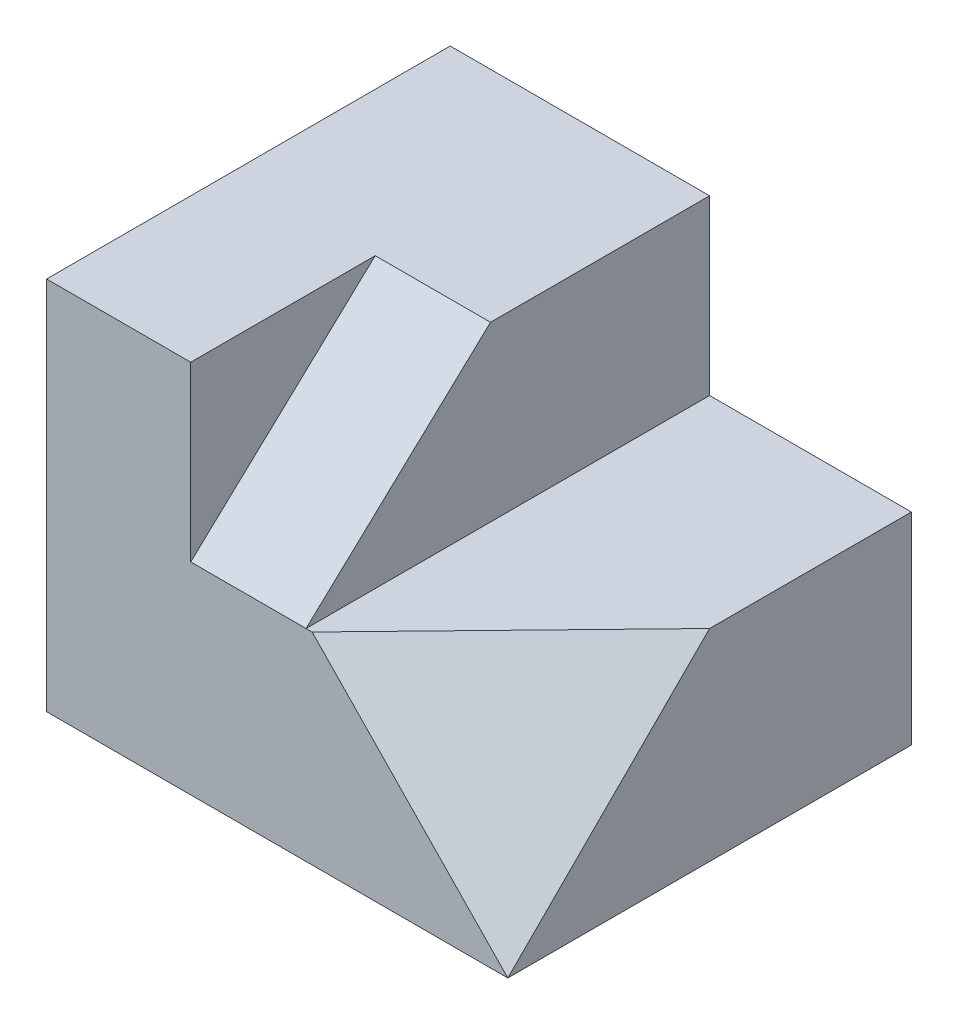
from build123d import *

# Parameters (mm, degrees)
CROQUIS1_W              = 80
CROQUIS1_H              = 70
SALIENTE_EXTRUIR1_DEPTH = 65
CROQUIS2_W              = 70
CROQUIS2_H              = 30
CORTAR_EXTRUIR1_DEPTH   = 35
CORTAR_EXTRUIR2_DEPTH   = 20
CORTAR_EXTRUIR3_DEPTH   = 20


with BuildPart() as part:
    # Croquis1 → Saliente-Extruir1 (new body)
    with BuildSketch(Plane(origin=(0, 0, 0), x_dir=(1, 0, 0), z_dir=(0, 1, 0))):
        with Locations((40, 35)):
            Rectangle(CROQUIS1_W, CROQUIS1_H)
    extrude(amount=SALIENTE_EXTRUIR1_DEPTH)

    # Croquis2 → Cortar-Extruir1 (cut)
    with BuildSketch(Plane(origin=(80, 0, 0), x_dir=(0, 0, -1), z_dir=(1, 0, 0))):
        with Locations((35, 50)):
            Rectangle(CROQUIS2_W, CROQUIS2_H)
    extrude(amount=-CORTAR_EXTRUIR1_DEPTH, mode=Mode.SUBTRACT)

    # Croquis3 → Cortar-Extruir2 (cut)
    with BuildSketch(Plane(origin=(45, 0, 0), x_dir=(0, 0, -1), z_dir=(1, 0, 0))):
        Polygon((0, 35), (32, 65), (0, 65), align=None)
    extrude(amount=-CORTAR_EXTRUIR2_DEPTH, mode=Mode.SUBTRACT)

    # Croquis6 → Cortar-Extruir3 (cut)
    with BuildSketch(Plane(origin=(27.763221793, 26.928249656, 26.928249656), x_dir=(0.4101501227910038, 0.39781495770089986, -0.8206827256644043), z_dir=(0.5891012412208205, 0.5713841648103704, 0.5713841648103701))):
        Polygon((32.812009823, -55.698422491), (75.459428741, -30.574775071), (32.812009823, -6.939578699), align=None)
    extrude(amount=CORTAR_EXTRUIR3_DEPTH, mode=Mode.SUBTRACT)


solid = part.part
